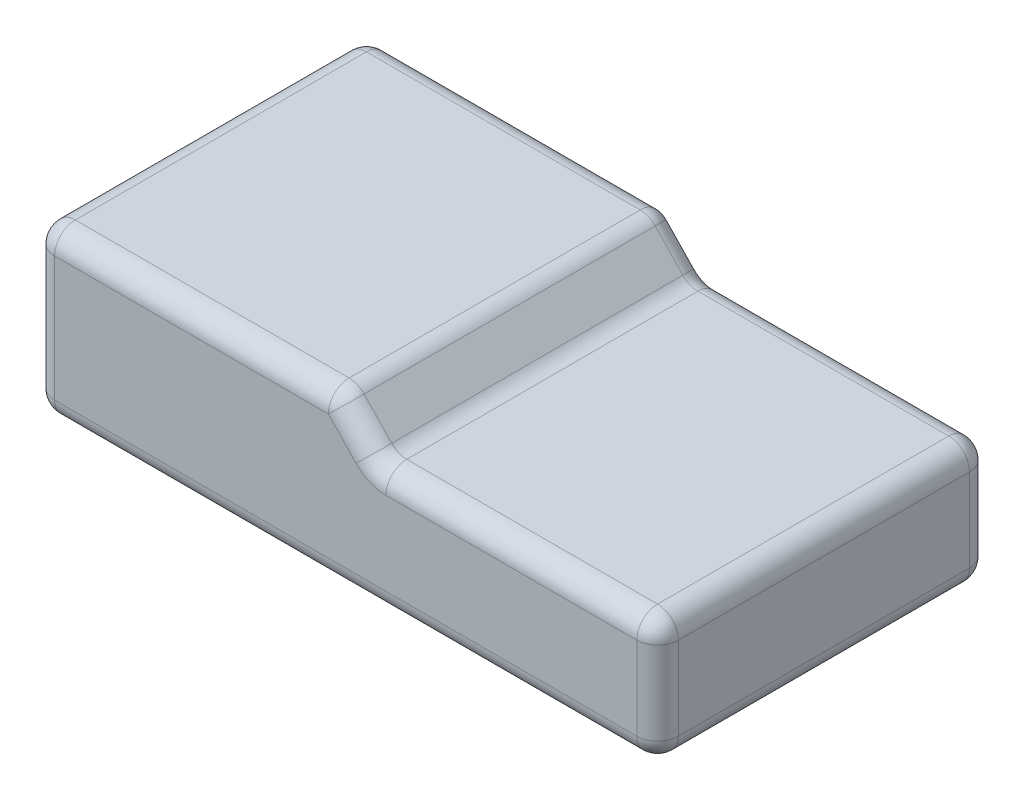
from build123d import *

# Parameters (mm, degrees)
BOSS_EXTRUDE1_DEPTH = 20.32
FILLET1_R           = 1.27


with BuildPart() as part:
    # Sketch1 → Boss-Extrude1 (new body)
    with BuildSketch(Plane.XY):
        Polygon((0, 0), (0, 10.16), (18.531128405, 10.16), (20.968059336, 7.62), (38.1, 7.62), (38.1, 0), align=None)
    extrude(amount=BOSS_EXTRUDE1_DEPTH)

    # Fillet1
    fillet1_edges = [part.edges().sort_by_distance(p)[0] for p in [
        (29.534029668, 7.62, 20.32),
        (0, 0, 10.16),
        (0, 10.16, 10.16),
        (18.531128405, 10.16, 10.16),
        (20.968059336, 7.62, 10.16),
        (38.1, 7.62, 10.16),
        (38.1, 0, 10.16),
        (19.74959387, 8.89, 20.32),
        (9.265564202, 10.16, 20.32),
        (0, 5.08, 20.32),
        (19.05, 0, 20.32),
        (0, 5.08, 0),
        (9.265564202, 10.16, 0),
        (19.74959387, 8.89, 0),
        (38.1, 3.81, 20.32),
        (29.534029668, 7.62, 0),
        (38.1, 3.81, 0),
        (19.05, 0, 0),
    ]]
    fillet(fillet1_edges, radius=FILLET1_R)


solid = part.part
